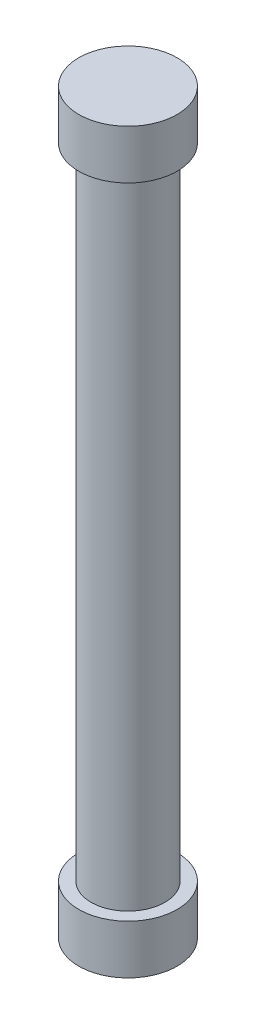
from build123d import *


with BuildPart() as part:
    # Sketch1 → Revolve1 (revolve)
    with BuildSketch(Plane.XY):
        Polygon((0, 23.3), (0, -6.7), (-2, -6.7), (-2, -4.7), (-1.5, -4.7), (-1.5, 21.3), (-2, 21.3), (-2, 23.3), align=None)
    revolve(axis=Axis((0, 23.3, 0), (0, -1, 0)))


solid = part.part
